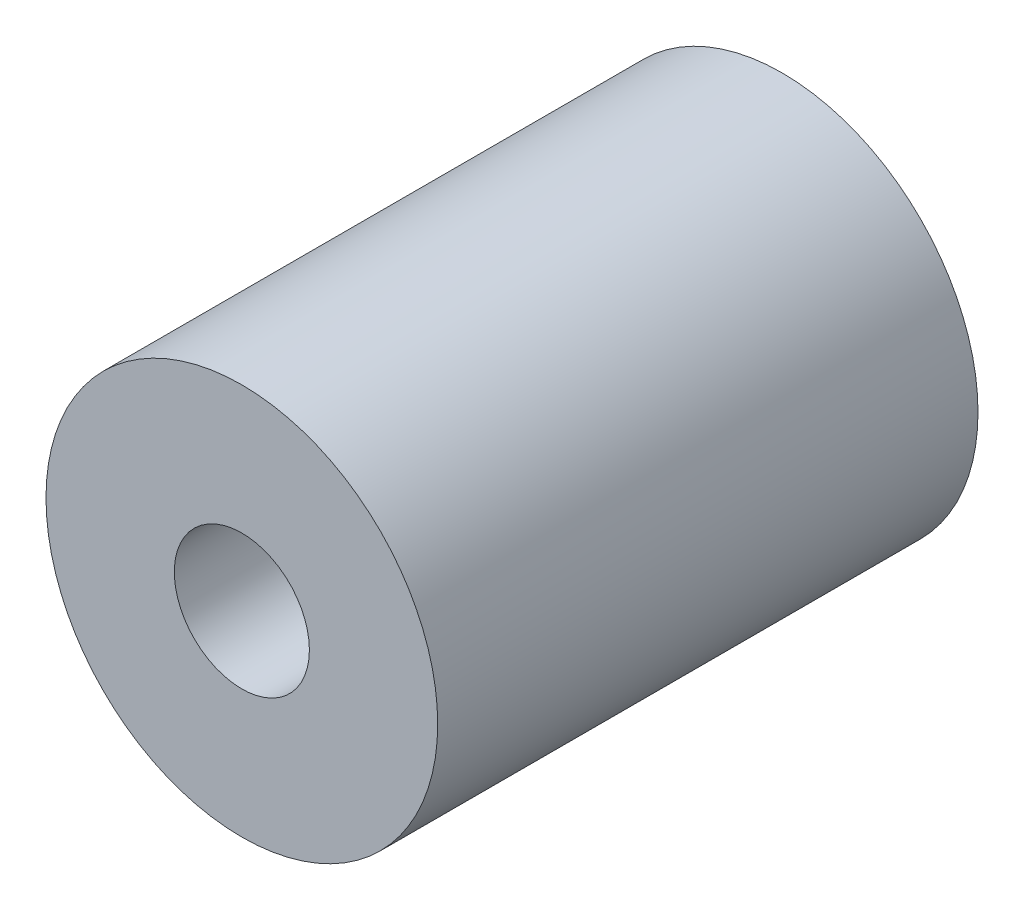
from build123d import *

# Parameters (mm, degrees)
SKETCH1_R           = 2.9
SKETCH1_R_2         = 1
BOSS_EXTRUDE1_DEPTH = 8


with BuildPart() as part:
    # Sketch1 → Boss-Extrude1 (new body)
    with BuildSketch(Plane.XY):
        Circle(SKETCH1_R)
        Circle(SKETCH1_R_2, mode=Mode.SUBTRACT)
    extrude(amount=BOSS_EXTRUDE1_DEPTH)


solid = part.part
